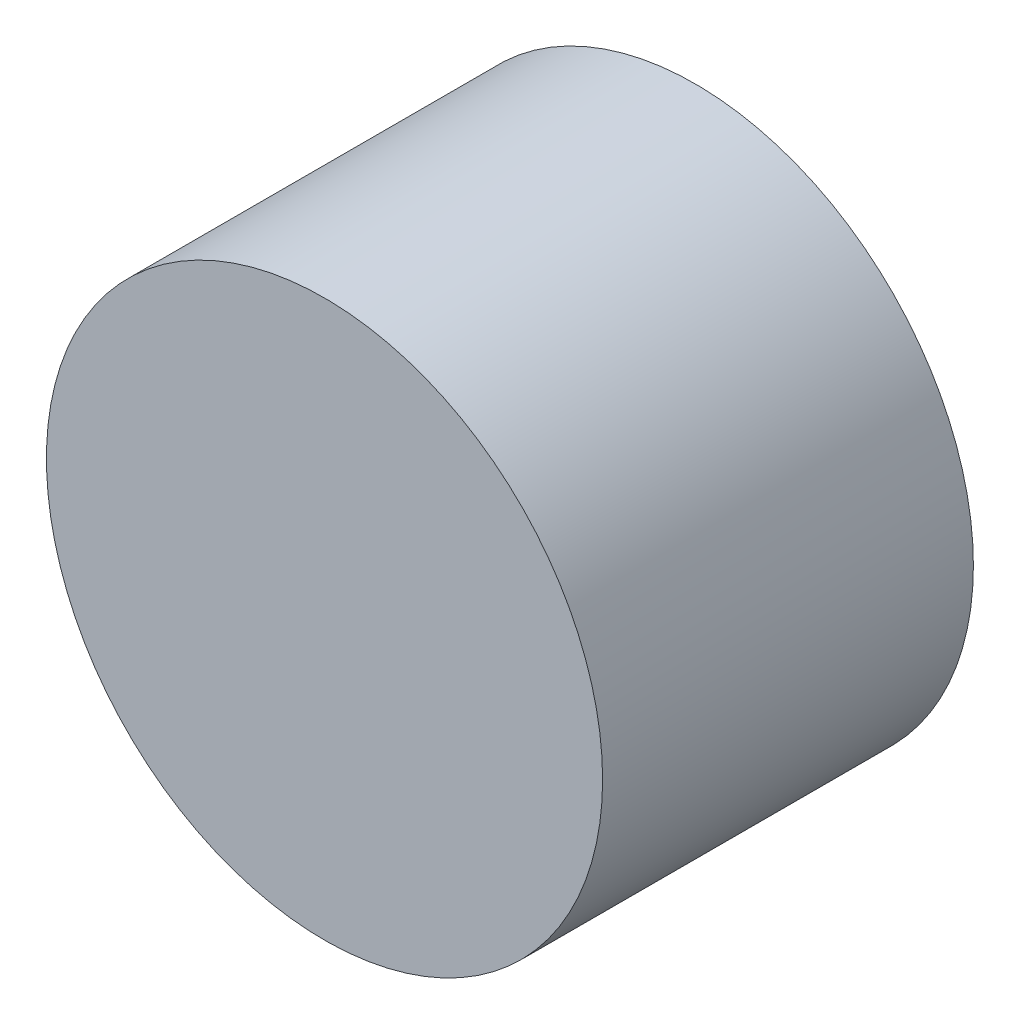
from build123d import *

# Parameters (mm, degrees)
SKETCH1_R           = 6
BOSS_EXTRUDE1_DEPTH = 8
SKETCH1_4_R         = 4.25
CUT_EXTRUDE1_DEPTH  = 5.5


with BuildPart() as part:
    # Sketch1 → Boss-Extrude1 (new body)
    with BuildSketch(Plane.XY):
        Circle(SKETCH1_R)
    extrude(amount=BOSS_EXTRUDE1_DEPTH)

    # Sketch1<4> → Cut-Extrude1 (cut)
    with BuildSketch(Plane.XY):
        Circle(SKETCH1_4_R)
    extrude(amount=CUT_EXTRUDE1_DEPTH, mode=Mode.SUBTRACT)


solid = part.part
